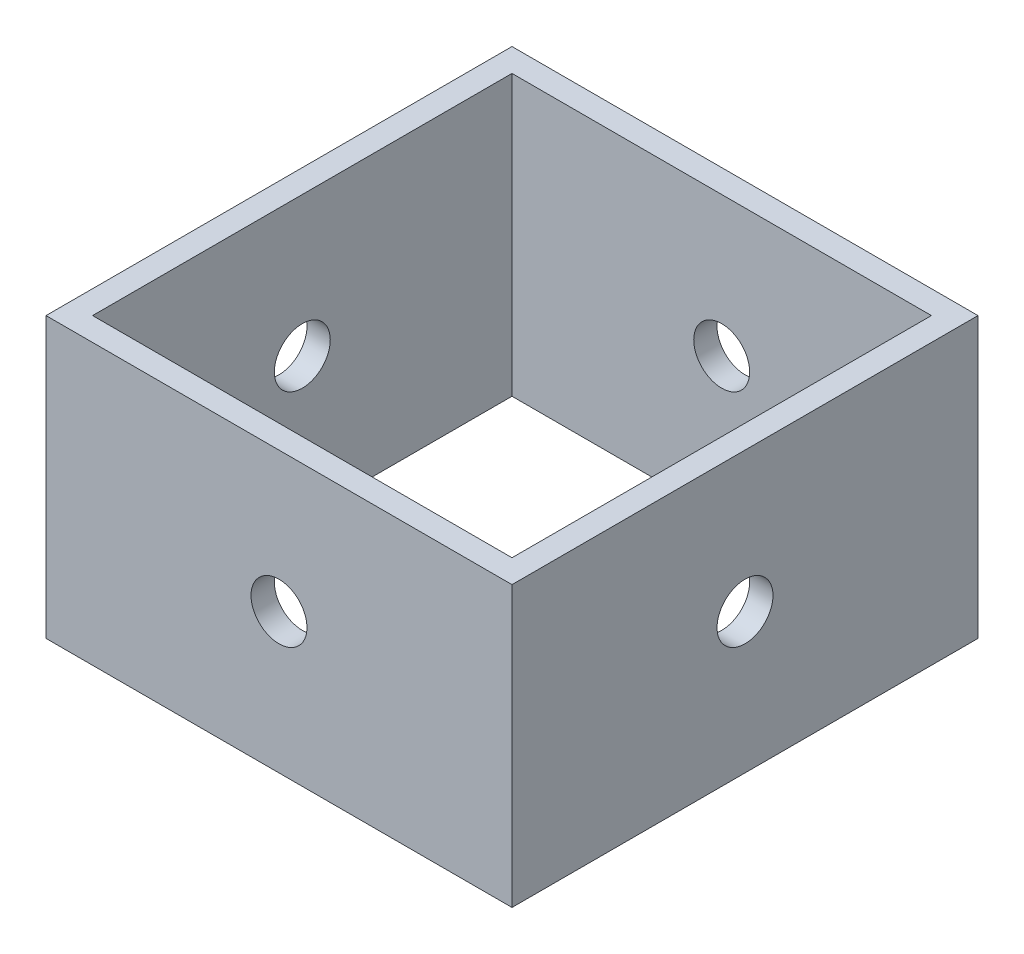
from build123d import *

# Parameters (mm, degrees)
SKETCH1_W           = 25
SKETCH1_H           = 25
SKETCH1_W_2         = 22.500853306
SKETCH1_H_2         = 22.500853306
BOSS_EXTRUDE1_DEPTH = 15
SKETCH2_R           = 1.5
CUT_EXTRUDE1_DEPTH  = 32.721443851
SKETCH3_R           = 1.5
CUT_EXTRUDE2_DEPTH  = 32.721443851


with BuildPart() as part:
    # Sketch1 → Boss-Extrude1 (new body)
    with BuildSketch(Plane(origin=(0, 0, 0), x_dir=(1, 0, 0), z_dir=(0, 1, 0))):
        Rectangle(SKETCH1_W, SKETCH1_H)
        Rectangle(SKETCH1_W_2, SKETCH1_H_2, mode=Mode.SUBTRACT)
    extrude(amount=BOSS_EXTRUDE1_DEPTH)

    # Sketch2 → Cut-Extrude1 (cut, through all)
    with BuildSketch(Plane(origin=(0, 0, -12.5), x_dir=(-1, 0, 0), z_dir=(0, 0, -1))):
        with Locations((0, 7.5)):
            Circle(SKETCH2_R)
    extrude(amount=-CUT_EXTRUDE1_DEPTH, mode=Mode.SUBTRACT)

    # Sketch3 → Cut-Extrude2 (cut, through all)
    with BuildSketch(Plane(origin=(12.5, 0, 0), x_dir=(0, 0, -1), z_dir=(1, 0, 0))):
        with Locations((0, 7.5)):
            Circle(SKETCH3_R)
    extrude(amount=-CUT_EXTRUDE2_DEPTH, mode=Mode.SUBTRACT)


solid = part.part
